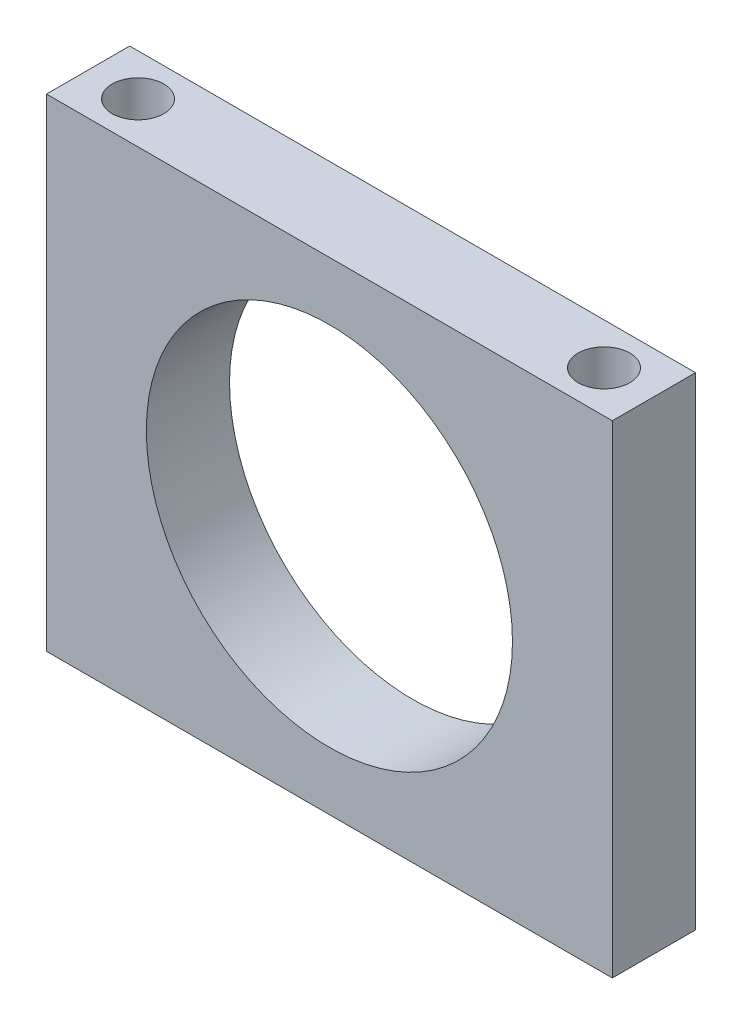
from build123d import *

# Parameters (mm, degrees)
SKETCH_1_W      = 34
SKETCH_1_H      = 29
SKETCH_1_R      = 11
EXTRUDE_1_DEPTH = 5
HOLE_WIZARD_1_D = 3.1


with BuildPart() as part:
    # 草图1 → 凸台-拉伸1 (new body)
    with BuildSketch(Plane.XY):
        Rectangle(SKETCH_1_W, SKETCH_1_H)
        Circle(SKETCH_1_R, mode=Mode.SUBTRACT)
    extrude(amount=EXTRUDE_1_DEPTH)

    # 孔1 (through all)
    with Locations(Plane(origin=(0, 14.5, 0), x_dir=(1, 0, 0), z_dir=(0, 1, 0))):
        with Locations((-14, -2.5), (14, -2.5)):
            Hole(HOLE_WIZARD_1_D / 2)


solid = part.part
